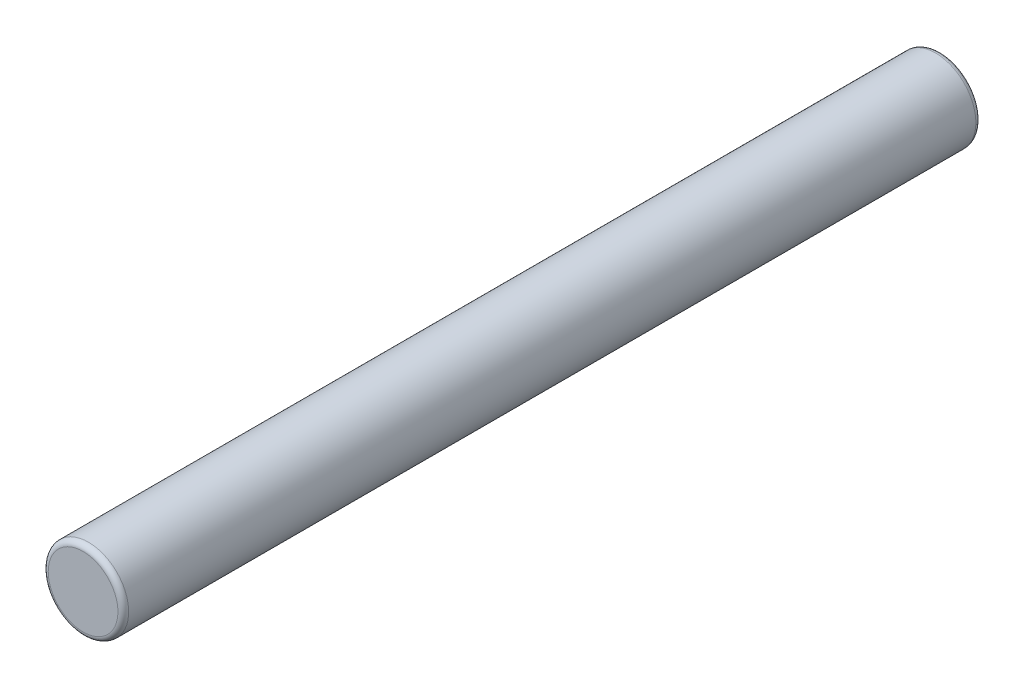
from build123d import *


with BuildPart() as part:
    # Sketch1 → Revolve1 (revolve)
    with BuildSketch(Plane(origin=(0, 0, 0), x_dir=(1, 0, 0), z_dir=(0, 1, 0)), mode=Mode.PRIVATE) as revolve1_sk:
        with BuildLine():
            Line((0, 16), (1.3, 16))
            ThreePointArc((1.3, 16), (1.441421356, 15.941421356), (1.5, 15.8))
            Line((1.5, 15.8), (1.5, -15.8))
            ThreePointArc((1.5, -15.8), (1.441421356, -15.941421356), (1.3, -16))
            Line((1.3, -16), (0, -16))
            Line((0, -16), (0, 16))
        make_face()
    revolve(revolve1_sk.sketch.rotate(Axis((0, 0, -16), (0, 0, 1)), 180), axis=Axis((0, 0, -16), (0, 0, 1)))


solid = part.part
